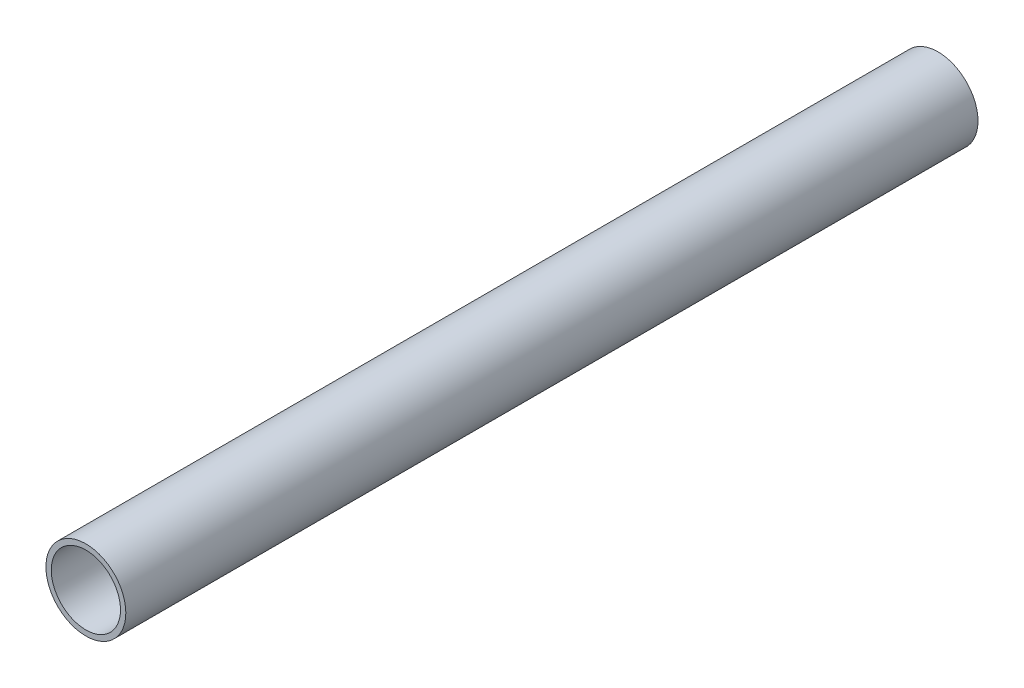
from build123d import *

# Parameters (mm, degrees)
SKETCH1_R           = 7.5
SKETCH1_R_2         = 6.5
BOSS_EXTRUDE1_DEPTH = 160


with BuildPart() as part:
    # Sketch1 → Boss-Extrude1 (new body)
    with BuildSketch(Plane.XY):
        Circle(SKETCH1_R)
        Circle(SKETCH1_R_2, mode=Mode.SUBTRACT)
    extrude(amount=BOSS_EXTRUDE1_DEPTH)


solid = part.part
